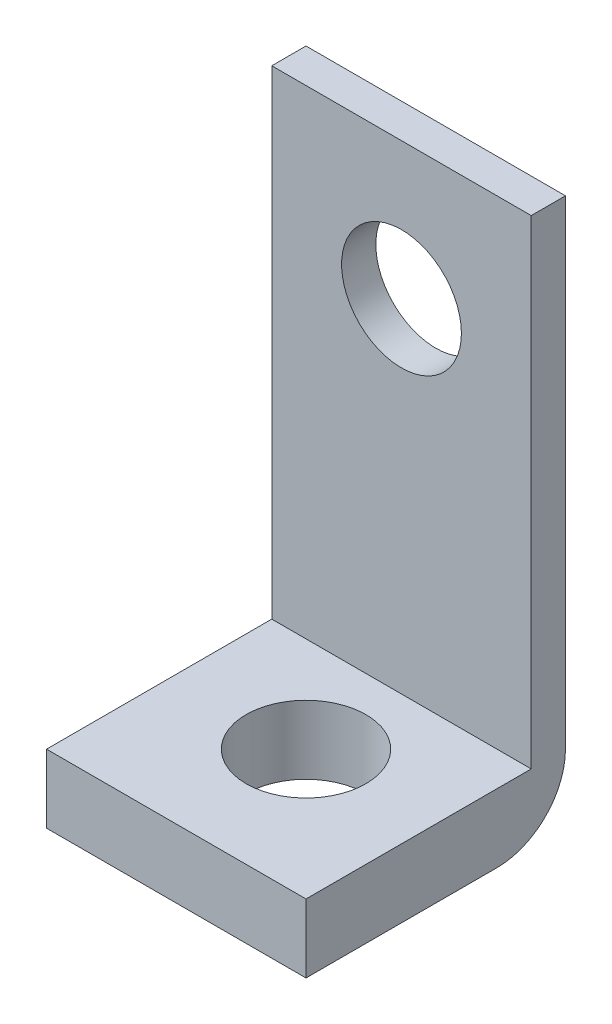
from build123d import *

# Parameters (mm, degrees)
SKETCH1_W           = 9.6266
SKETCH1_H           = 8.3566
SKETCH1_R           = 2.2225
BOSS_EXTRUDE1_DEPTH = 2.54
SKETCH1_3_W         = 9.6266
SKETCH1_3_H         = 1.27
BOSS_EXTRUDE2_DEPTH = 20.32
CUT_EXTRUDE1_REACH  = 24.492
SKETCH2_R           = 2.2225
FILLET1_R           = 2.54


with BuildPart() as part:
    # Sketch1 → Boss-Extrude1 (new body)
    with BuildSketch(Plane(origin=(0, 0, 0), x_dir=(1, 0, 0), z_dir=(0, 1, 0))):
        with Locations((0, -0.635)):
            Rectangle(SKETCH1_W, SKETCH1_H)
        Circle(SKETCH1_R, mode=Mode.SUBTRACT)
    extrude(amount=BOSS_EXTRUDE1_DEPTH)

    # Sketch1<3> → Boss-Extrude2 (add)
    with BuildSketch(Plane(origin=(0, 0, 0), x_dir=(1, 0, 0), z_dir=(0, 1, 0))):
        with Locations((0, 4.1783)):
            Rectangle(SKETCH1_3_W, SKETCH1_3_H)
    extrude(amount=BOSS_EXTRUDE2_DEPTH)

    # Sketch2 → Cut-Extrude1 (cut, up to next)
    with BuildSketch(Plane.XY.offset(-3.5433), mode=Mode.PRIVATE) as cut_extrude1_sk1:
        with Locations((0, 15.24)):
            Circle(SKETCH2_R)
    cut_extrude1_tool1 = extrude(cut_extrude1_sk1.sketch, amount=-CUT_EXTRUDE1_REACH, mode=Mode.PRIVATE) & part.part
    add(cut_extrude1_tool1.solids().sort_by_distance((0, 15.24, -3.5433))[0], mode=Mode.SUBTRACT)

    # Fillet1
    fillet1_edges = [part.edges().sort_by_distance(p)[0] for p in [
        (0, 0, -4.8133),
    ]]
    fillet(fillet1_edges, radius=FILLET1_R)


solid = part.part
